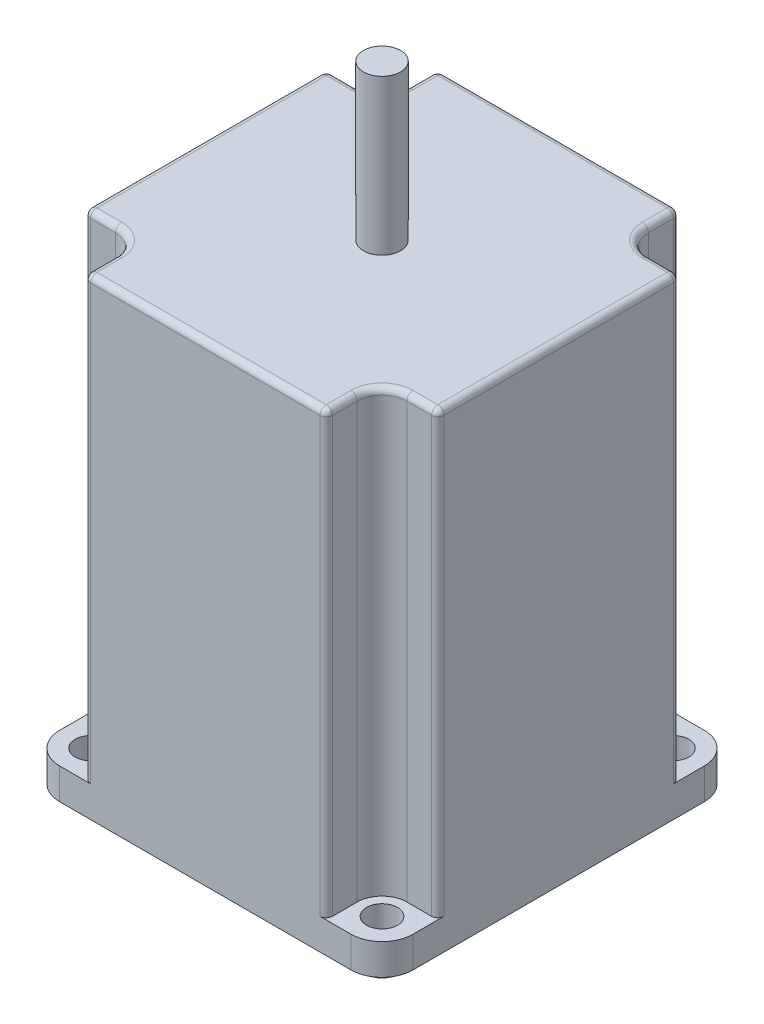
from build123d import *

# Parameters (mm, degrees)
SKETCH1_W                = 57
SKETCH1_H                = 57
EXTRUDE1_DEPTH           = 76
F_5_0_5_DIAMETER_HOLE1_D = 5
SKETCH6_R                = 4
SKETCH6_R_2              = 2.5
EXTRUDE4_DEPTH           = 71
FILLET1_R                = 5
EXTRUDE5_DEPTH           = 25
EXTRUDE5_DEPTH_BACK      = 101
SKETCH7_R                = 3
SKETCH8_R                = 15
EXTRUDE6_DEPTH           = 3
FILLET2_R                = 1


with BuildPart() as part:
    # Sketch1 → Extrude1 (new body)
    with BuildSketch(Plane(origin=(0, 0, 0), x_dir=(1, 0, 0), z_dir=(0, 1, 0))):
        Rectangle(SKETCH1_W, SKETCH1_H)
    extrude(amount=EXTRUDE1_DEPTH)

    # Ø5.0 (5) Diameter Hole1 (through all)
    with Locations(Plane.XZ):
        with Locations((-23.5, 23.5), (23.5, 23.5), (23.5, -23.5), (-23.5, -23.5)):
            Hole(F_5_0_5_DIAMETER_HOLE1_D / 2)

    # Sketch6 → Extrude4 (cut)
    # profile 1 of 12: a face of its own
    with BuildSketch(Plane(origin=(0, 76, 0), x_dir=(1, 0, 0), z_dir=(0, 1, 0))):
        Polygon((-28.5, 28.5), (-19.5, 28.5), (-19.5, 32.511741208), (-33.908905561, 32.511741208), (-33.908905561, 19.5), (-28.5, 19.5), align=None)
    # profile 2 of 12: a face of its own
    with BuildSketch(Plane(origin=(0, 76, 0), x_dir=(1, 0, 0), z_dir=(0, 1, 0))):
        with BuildLine():
            ThreePointArc((-23.5, 19.5), (-26.328427125, 26.328427125), (-19.5, 23.5))
            Line((-19.5, 23.5), (-19.5, 28.5))
            Line((-19.5, 28.5), (-28.5, 28.5))
            Line((-28.5, 28.5), (-28.5, 19.5))
            Line((-28.5, 19.5), (-23.5, 19.5))
        make_face()
    # profile 3 of 12: a face of its own
    with BuildSketch(Plane(origin=(0, 76, 0), x_dir=(1, 0, 0), z_dir=(0, 1, 0))):
        with Locations((-23.5, 23.5)):
            Circle(SKETCH6_R)
        with Locations(Location((-23.5, 23.5, 0), (0, 0, 90))):
            Circle(SKETCH6_R_2, mode=Mode.SUBTRACT)
    # profile 4 of 12: a face of its own
    with BuildSketch(Plane(origin=(0, 76, 0), x_dir=(1, 0, 0), z_dir=(0, 1, 0))):
        Polygon((19.5, 36.471560472), (19.5, 28.5), (28.5, 28.5), (28.5, 19.5), (41.168352552, 19.5), (41.168352552, 36.471560472), align=None)
    # profile 5 of 12: a face of its own
    with BuildSketch(Plane(origin=(0, 76, 0), x_dir=(1, 0, 0), z_dir=(0, 1, 0))):
        with BuildLine():
            Line((28.5, 28.5), (19.5, 28.5))
            Line((19.5, 28.5), (19.5, 23.5))
            ThreePointArc((19.5, 23.5), (23.5, 27.5), (27.5, 23.5))
            ThreePointArc((27.5, 23.5), (26.328427125, 20.671572875), (23.5, 19.5))
            Line((23.5, 19.5), (28.5, 19.5))
            Line((28.5, 19.5), (28.5, 28.5))
        make_face()
    # profile 6 of 12: a face of its own
    with BuildSketch(Plane(origin=(0, 76, 0), x_dir=(1, 0, 0), z_dir=(0, 1, 0))):
        with Locations((23.5, 23.5)):
            Circle(SKETCH6_R)
        with Locations(Location((23.5, 23.5, 0), (0, 0, 90))):
            Circle(SKETCH6_R_2, mode=Mode.SUBTRACT)
    # profile 7 of 12: a face of its own
    with BuildSketch(Plane(origin=(0, 76, 0), x_dir=(1, 0, 0), z_dir=(0, 1, 0))):
        with Locations((23.5, -23.5)):
            Circle(SKETCH6_R)
        with Locations(Location((23.5, -23.5, 0), (0, 0, 90))):
            Circle(SKETCH6_R_2, mode=Mode.SUBTRACT)
    # profile 8 of 12: a face of its own
    with BuildSketch(Plane(origin=(0, 76, 0), x_dir=(1, 0, 0), z_dir=(0, 1, 0))):
        with BuildLine():
            Line((28.5, -28.5), (28.5, -19.5))
            Line((28.5, -19.5), (23.5, -19.5))
            ThreePointArc((23.5, -19.5), (26.328427125, -20.671572875), (27.5, -23.5))
            ThreePointArc((27.5, -23.5), (23.5, -27.5), (19.5, -23.5))
            Line((19.5, -23.5), (19.5, -28.5))
            Line((19.5, -28.5), (28.5, -28.5))
        make_face()
    # profile 9 of 12: a face of its own
    with BuildSketch(Plane(origin=(0, 76, 0), x_dir=(1, 0, 0), z_dir=(0, 1, 0))):
        Polygon((44.252209519, -19.5), (28.5, -19.5), (28.5, -28.5), (19.5, -28.5), (19.5, -40.050429997), (44.252209519, -40.050429997), align=None)
    # profile 10 of 12: a face of its own
    with BuildSketch(Plane(origin=(0, 76, 0), x_dir=(1, 0, 0), z_dir=(0, 1, 0))):
        Polygon((-28.5, -28.5), (-28.5, -19.5), (-37.670786859, -19.5), (-37.670786859, -37.828231874), (-19.5, -37.828231874), (-19.5, -28.5), align=None)
    # profile 11 of 12: a face of its own
    with BuildSketch(Plane(origin=(0, 76, 0), x_dir=(1, 0, 0), z_dir=(0, 1, 0))):
        with BuildLine():
            Line((-23.5, -19.5), (-28.5, -19.5))
            Line((-28.5, -19.5), (-28.5, -28.5))
            Line((-28.5, -28.5), (-19.5, -28.5))
            Line((-19.5, -28.5), (-19.5, -23.5))
            ThreePointArc((-19.5, -23.5), (-26.328427125, -26.328427125), (-23.5, -19.5))
        make_face()
    # profile 12 of 12: a face of its own
    with BuildSketch(Plane(origin=(0, 76, 0), x_dir=(1, 0, 0), z_dir=(0, 1, 0))):
        with Locations((-23.5, -23.5)):
            Circle(SKETCH6_R)
        with Locations(Location((-23.5, -23.5, 0), (0, 0, 90))):
            Circle(SKETCH6_R_2, mode=Mode.SUBTRACT)
    extrude(amount=-EXTRUDE4_DEPTH, mode=Mode.SUBTRACT)

    # Fillet1
    fillet1_edges = [part.edges().sort_by_distance(p)[0] for p in [
        (-28.5, 2.5, 28.5),
        (-28.5, 2.5, -28.5),
        (28.5, 2.5, -28.5),
        (28.5, 2.5, 28.5),
    ]]
    fillet(fillet1_edges, radius=FILLET1_R)



with BuildPart() as body_2:
    # Sketch7 → Extrude5 (new, two sides: drawn at the far end of the back side and taken through both)
    with BuildSketch(Plane(origin=(0, 76, 0), x_dir=(1, 0, 0), z_dir=(0, 1, 0)).offset(-EXTRUDE5_DEPTH_BACK)):
        with Locations(Location((0, 0, 0), (0, 0, 270))):
            Circle(SKETCH7_R)
    extrude(amount=EXTRUDE5_DEPTH + EXTRUDE5_DEPTH_BACK)


with BuildPart() as part_1:
    add(part.part)

    add(body_2.part)  # Extrude6 merges body 2
    # Sketch8 → Extrude6 (add)
    with BuildSketch(Plane.XZ):
        with Locations(Location((0, 0, 0), (0, 0, 270))):
            Circle(SKETCH8_R)
    extrude(amount=EXTRUDE6_DEPTH)

    # Fillet2
    fillet2_edges = [part_1.edges().sort_by_distance(p)[0] for p in [
        (-28.5, 40.5, 19.5),
        (0, 76, 28.5),
        (-19.5, 40.5, 28.5),
        (-19.5, 76, 26),
        (-20.671572875, 76, 20.671572875),
        (-26, 76, 19.5),
        (-28.5, 76, 0),
        (-28.5, 40.5, -19.5),
        (-19.5, 40.5, -28.5),
        (-19.5, 76, -26),
        (-26, 76, -19.5),
        (-20.671572875, 76, -20.671572875),
        (0, 76, -28.5),
        (19.5, 76, -26),
        (26, 76, -19.5),
        (20.671572875, 76, -20.671572875),
        (19.5, 40.5, -28.5),
        (28.5, 40.5, -19.5),
        (19.5, 40.5, 28.5),
        (28.5, 76, 0),
        (26, 76, 19.5),
        (19.5, 76, 26),
        (20.671572875, 76, 20.671572875),
        (28.5, 40.5, 19.5),
    ]]
    fillet(fillet2_edges, radius=FILLET2_R)


solid = part_1.part
